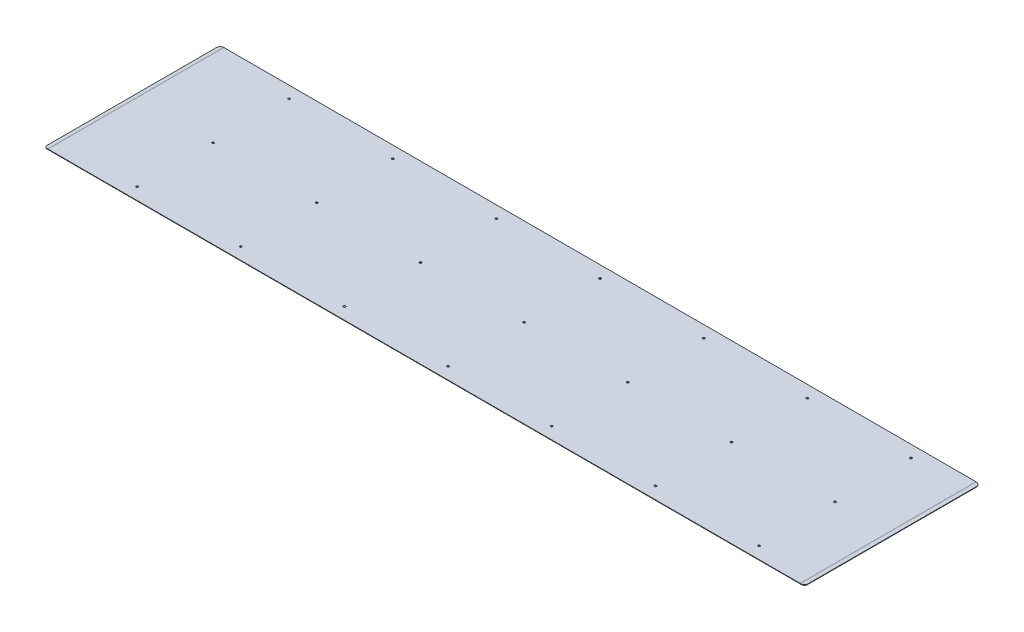
from build123d import *

# Parameters (mm, degrees)
ESTRUSIONE_ESTRUSIONE1_DEPTH = 254.5
RACCORDO1_R                  = 10
SCHIZZO2_R                   = 3
TAGLIO_ESTRUSIONE1_DEPTH     = 2
RIPETIZIONE_A_L1_COUNT       = 4
RIPETIZIONE_A_L1_PITCH       = 300
RIPETIZIONE_A_L1_COL_COUNT   = 4
RIPETIZIONE_A_L1_COL_PITCH   = 300


with BuildPart() as part:
    # Schizzo1 → Estrusione-Estrusione1 (new, symmetric)
    with BuildSketch(Plane.XY):
        with BuildLine():
            Line((-1089.232382107, 0.706239028), (-1100, -0.235805471))
            Line((-1100, -0.235805471), (-1099.860182927, -1.833921932))
            Line((-1099.860182927, -1.833921932), (-1087.90584655, -0.788053019))
            ThreePointArc((-1087.90584655, -0.788053019), (-1087.470482996, -0.759517784), (-1087.034289122, -0.75))
            Line((-1087.034289122, -0.75), (1087.034289122, -0.75))
            ThreePointArc((1087.034289122, -0.75), (1087.470482996, -0.759517784), (1087.90584655, -0.788053019))
            Line((1087.90584655, -0.788053019), (1099.860182927, -1.833921932))
            Line((1099.860182927, -1.833921932), (1100, -0.235805471))
            Line((1100, -0.235805471), (1089.232382107, 0.706239028))
            ThreePointArc((1089.232382107, 0.706239028), (1088.73171402, 0.739054548), (1088.230091065, 0.75))
            Line((1088.230091065, 0.75), (-1088.230091065, 0.75))
            ThreePointArc((-1088.230091065, 0.75), (-1088.73171402, 0.739054548), (-1089.232382107, 0.706239028))
        make_face()
    extrude(amount=ESTRUSIONE_ESTRUSIONE1_DEPTH, both=True)

    # Raccordo1
    raccordo1_edges = [part.edges().sort_by_distance(p)[0] for p in [
        (1099.930091463, -1.034863701, -254.5),
        (-1099.930091463, -1.034863701, -254.5),
        (1099.930091463, -1.034863701, 254.5),
        (-1099.930091463, -1.034863701, 254.5),
    ]]
    fillet(raccordo1_edges, radius=RACCORDO1_R)

    # Schizzo2 → Taglio-Estrusione1 (cut)
    with BuildSketch(Plane(origin=(0, 0.75, 0), x_dir=(1, 0, 0), z_dir=(0, 1, 0))):
        with Locations(Location((35, -220, 0), (0, 0, 180))):
            Circle(SCHIZZO2_R)
        with Locations(Location((35, 220, 0), (0, 0, 180))):
            Circle(SCHIZZO2_R)
        with Locations(Location((35, 0, 0), (0, 0, 180))):
            Circle(SCHIZZO2_R)
    taglio_estrusione1 = extrude(amount=-TAGLIO_ESTRUSIONE1_DEPTH, mode=Mode.SUBTRACT)

    # Ripetizione a L1: Taglio-Estrusione1 ×4
    with Locations(*[(i * RIPETIZIONE_A_L1_PITCH, 0, 0) for i in range(1, RIPETIZIONE_A_L1_COUNT)]):
        add(taglio_estrusione1, mode=Mode.SUBTRACT)

    # Ripetizione a L1 col: Taglio-Estrusione1 ×4
    with Locations(*[(-i * RIPETIZIONE_A_L1_COL_PITCH, 0, 0) for i in range(1, RIPETIZIONE_A_L1_COL_COUNT)]):
        add(taglio_estrusione1, mode=Mode.SUBTRACT)


solid = part.part
